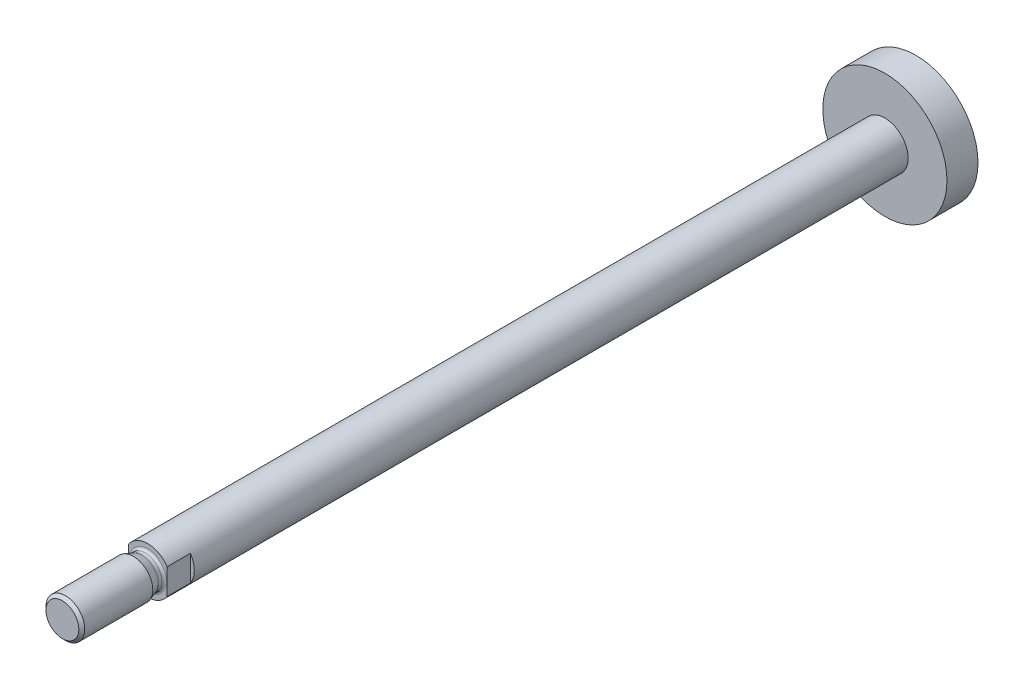
from build123d import *

# Parameters (mm, degrees)
SCHNITT_LINEAR_AUSTRAGEN1_DEPTH = 7


with BuildPart() as part:
    # Skizze1 → Rotation1 (revolve)
    with BuildSketch(Plane(origin=(0, 0, 0), x_dir=(0, 0, -1), z_dir=(1, 0, 0))):
        Polygon((-8, 0), (-8, 6), (182, 6), (182, 16), (190, 16), (190, 0), align=None)
    revolve(axis=Axis((0, 0, -190), (0, 0, 1)))

    # Skizze2 → Rotation2 (revolve)
    with BuildSketch(Plane(origin=(0, 0, 0), x_dir=(0, 0, -1), z_dir=(1, 0, 0))):
        with BuildLine():
            Line((-30, 0), (-30, 4.233))
            Line((-30, 4.233), (-29.233, 5))
            Line((-29.233, 5), (-11.697981936, 5))
            Line((-11.697981936, 5), (-9.599415898, 4.236184428))
            ThreePointArc((-9.599415898, 4.236184428), (-9.498392718, 4.209115348), (-9.394203812, 4.2))
            Line((-9.394203812, 4.2), (-8.6, 4.2))
            ThreePointArc((-8.6, 4.2), (-8.175735931, 4.375735931), (-8, 4.8))
            Line((-8, 4.8), (-8, 5))
            Line((-8, 5), (-7, 5))
            Line((-7, 5), (-7, 0))
            Line((-7, 0), (-30, 0))
        make_face()
    revolve(axis=Axis((0, 0, 7), (0, 0, 1)))

    # Skizze3 → Schnitt-Linear austragen1 (cut)
    with BuildSketch(Plane.XY.offset(2)):
        Polygon((-10, 20), (-10, -10), (-5, -10), (-5, 10), (5, 10), (5, -10), (10, -10), (10, 20), align=None)
    extrude(amount=SCHNITT_LINEAR_AUSTRAGEN1_DEPTH, mode=Mode.SUBTRACT)


solid = part.part
